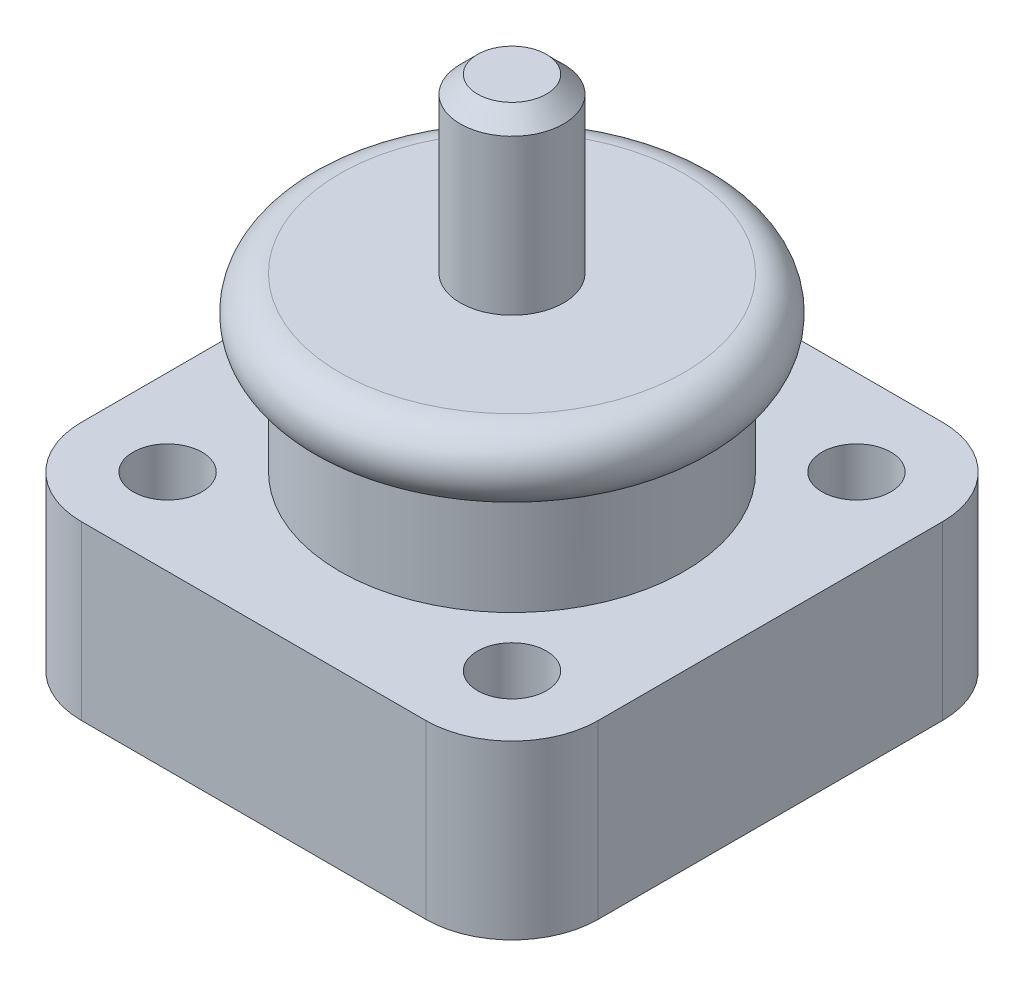
from build123d import *

# Parameters (mm, degrees)
SKETCH1_R           = 2
BOSS_EXTRUDE1_DEPTH = 10
SKETCH2_R           = 10
BOSS_EXTRUDE2_DEPTH = 10
SKETCH3_R           = 2
SKETCH4_R           = 3
BOSS_EXTRUDE3_DEPTH = 10
CHAMFER1_SIZE       = 1
SKETCH5_R           = 8
CUT_EXTRUDE1_DEPTH  = 2


with BuildPart() as part:
    # Sketch1 → Boss-Extrude1 (new body)
    with BuildSketch(Plane(origin=(0, 0, 0), x_dir=(1, 0, 0), z_dir=(0, 1, 0))):
        with BuildLine():
            Line((-10, -15), (10, -15))
            ThreePointArc((10, -15), (13.535533906, -13.535533906), (15, -10))
            Line((15, -10), (15, 10))
            ThreePointArc((15, 10), (13.535533906, 13.535533906), (10, 15))
            Line((10, 15), (-10, 15))
            ThreePointArc((-10, 15), (-13.535533906, 13.535533906), (-15, 10))
            Line((-15, 10), (-15, -10))
            ThreePointArc((-15, -10), (-13.535533906, -13.535533906), (-10, -15))
        make_face()
        with Locations(Location((-10, 10, 0), (0, 0, 270))):
            Circle(SKETCH1_R, mode=Mode.SUBTRACT)
        with Locations(Location((10, 10, 0), (0, 0, 270))):
            Circle(SKETCH1_R, mode=Mode.SUBTRACT)
        with Locations(Location((-10, -10, 0), (0, 0, 270))):
            Circle(SKETCH1_R, mode=Mode.SUBTRACT)
        with Locations(Location((10, -10, 0), (0, 0, 270))):
            Circle(SKETCH1_R, mode=Mode.SUBTRACT)
    extrude(amount=BOSS_EXTRUDE1_DEPTH)

    # Sketch2 → Boss-Extrude2 (add)
    with BuildSketch(Plane(origin=(0, 10, 0), x_dir=(1, 0, 0), z_dir=(0, 1, 0))):
        with Locations(Location((0, 0, 0), (0, 0, 270))):
            Circle(SKETCH2_R)
    extrude(amount=BOSS_EXTRUDE2_DEPTH)

    # Sketch3 → Revolve1 (revolve)
    with BuildSketch(Plane(origin=(0, 0, 0), x_dir=(0, 0, -1), z_dir=(1, 0, 0))):
        with Locations((-10, 18)):
            Circle(SKETCH3_R)
    revolve(axis=Axis((0, 0, 0), (0, 1, 0)))

    # Sketch4 → Boss-Extrude3 (add)
    with BuildSketch(Plane(origin=(0, 20, 0), x_dir=(1, 0, 0), z_dir=(0, 1, 0))):
        with Locations(Location((0, 0, 0), (0, 0, 270))):
            Circle(SKETCH4_R)
    extrude(amount=BOSS_EXTRUDE3_DEPTH)

    # Chamfer1
    chamfer1_edges = [part.edges().sort_by_distance(p)[0] for p in [
        (0, 30, -3),
    ]]
    chamfer(chamfer1_edges, length=CHAMFER1_SIZE)

    # Sketch5 → Cut-Extrude1 (cut)
    with BuildSketch(Plane.XZ):
        with Locations(Location((0, 0, 0), (0, 0, 270))):
            Circle(SKETCH5_R)
    extrude(amount=-CUT_EXTRUDE1_DEPTH, mode=Mode.SUBTRACT)


solid = part.part
